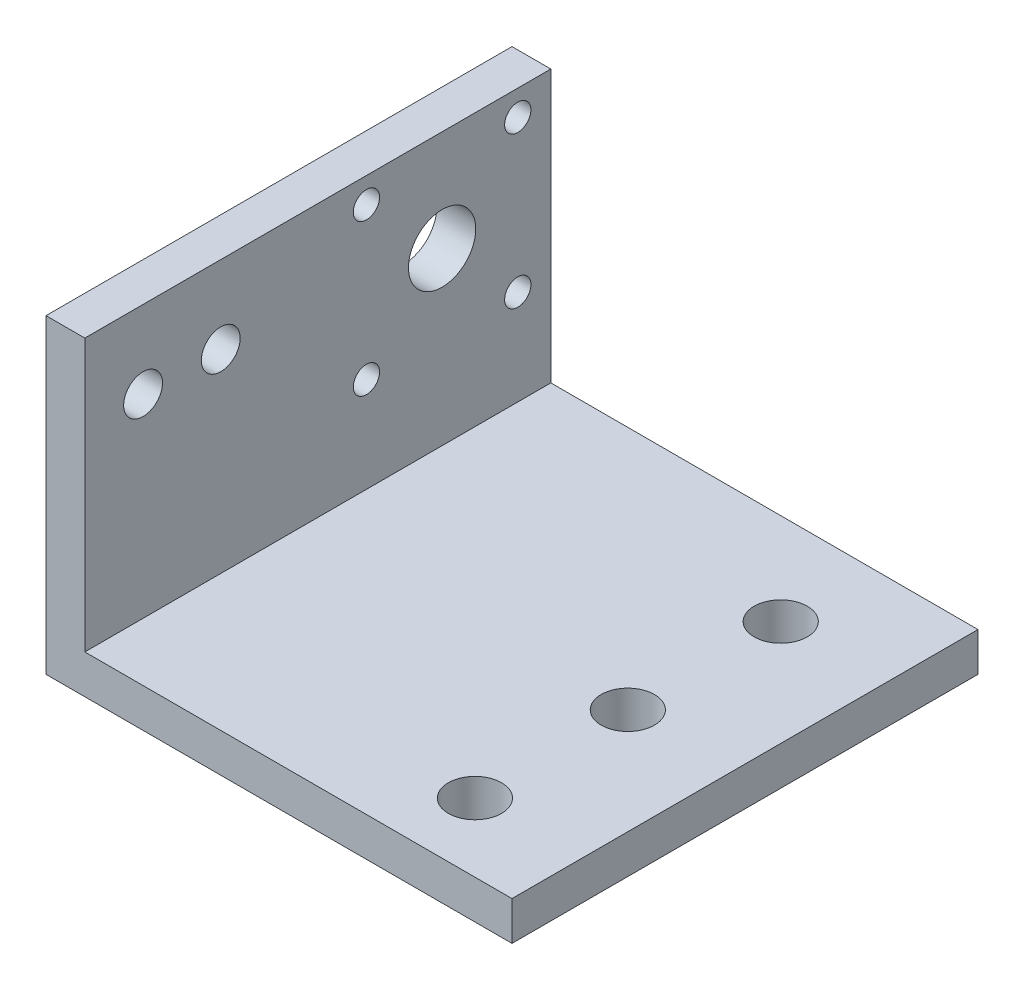
from build123d import *

# Parameters (mm, degrees)
BOSS_EXTRUDE1_DEPTH  = 76.2
M4_CLEARANCE_HOLE1_D = 4.3
SKETCH2_R            = 5.5
CUT_EXTRUDE1_DEPTH   = 8.636
SKETCH6_R            = 4.35
CUT_EXTRUDE2_DEPTH   = 13.97
CUT_EXTRUDE3_REACH   = 114.405
SKETCH7_R            = 3.175


with BuildPart() as part:
    # Sketch1 → Boss-Extrude1 (new body)
    with BuildSketch(Plane.XY):
        Polygon((-35.999033751, 18.830418264), (-35.999033751, -25.619581736), (33.850966249, -25.619581736), (33.850966249, -31.969581736), (-42.349033751, -31.969581736), (-42.349033751, 18.830418264), align=None)
    extrude(amount=BOSS_EXTRUDE1_DEPTH)

    # M4 Clearance Hole1 (through all)
    with Locations(Plane(origin=(-35.999033751, 0, 0), x_dir=(0, 0, -1), z_dir=(1, 0, 0))):
        with Locations((-30.154792935, 14.695211199), (-30.154792935, -10.054374671), (-5.405207065, -10.054374671), (-5.405207065, 14.695211199)):
            Hole(M4_CLEARANCE_HOLE1_D / 2)

    # Sketch2 → Cut-Extrude1 (cut)
    with BuildSketch(Plane(origin=(-35.999033751, 0, 0), x_dir=(0, 0, -1), z_dir=(1, 0, 0))):
        with Locations((-17.78, 2.320418264)):
            Circle(SKETCH2_R)
    extrude(amount=-CUT_EXTRUDE1_DEPTH, mode=Mode.SUBTRACT)

    # Sketch6 → Cut-Extrude2 (cut)
    with BuildSketch(Plane.XZ.offset(31.969581736)):
        with Locations(Location((16.591266249, 65, 0), (0, 0, 270))):
            Circle(SKETCH6_R)
        with Locations(Location((16.591266249, 15, 0), (0, 0, 270))):
            Circle(SKETCH6_R)
        with Locations(Location((16.591266249, 40, 0), (0, 0, 270))):
            Circle(SKETCH6_R)
    extrude(amount=-CUT_EXTRUDE2_DEPTH, mode=Mode.SUBTRACT)

    # Sketch7 → Cut-Extrude3 (cut, up to next)
    with BuildSketch(Plane.ZY.offset(42.349033751), mode=Mode.PRIVATE) as cut_extrude3_sk1:
        with Locations(Location((53.975, 6.130418264, 0), (0, 0, 270))):
            Circle(SKETCH7_R)
    cut_extrude3_tool1 = extrude(cut_extrude3_sk1.sketch, amount=-CUT_EXTRUDE3_REACH, mode=Mode.PRIVATE) & part.part
    # Sketch7 → Cut-Extrude3 (cut, up to next)
    with BuildSketch(Plane.ZY.offset(42.349033751), mode=Mode.PRIVATE) as cut_extrude3_sk2:
        with Locations(Location((66.675, 6.130418264, 0), (0, 0, 270))):
            Circle(SKETCH7_R)
    cut_extrude3_tool2 = extrude(cut_extrude3_sk2.sketch, amount=-CUT_EXTRUDE3_REACH, mode=Mode.PRIVATE) & part.part
    add(cut_extrude3_tool1.solids().sort_by_distance((-42.349034, 6.130418, 53.975))[0], mode=Mode.SUBTRACT)
    add(cut_extrude3_tool2.solids().sort_by_distance((-42.349034, 6.130418, 66.675))[0], mode=Mode.SUBTRACT)


solid = part.part
